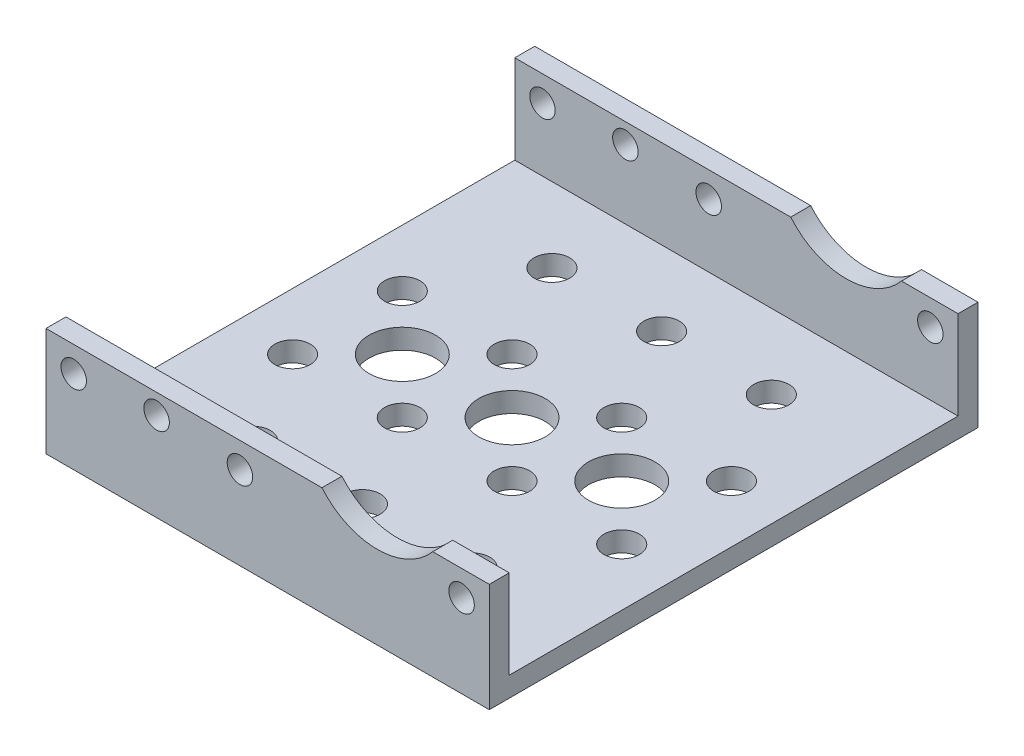
from build123d import *

# Parameters (mm, degrees)
SKETCH_1_W          = 40
SKETCH_1_H          = 40.5
EXTRUDE_1_DEPTH     = 1.8
SKETCH_2_R          = 1.6
SKETCH_2_R_2        = 3
CUT_EXTRUDE_1_DEPTH = 2
SKETCH_3_W          = 40
SKETCH_3_H          = 9.8
EXTRUDE_2_DEPTH     = 1.8
SKETCH_4_R          = 1.15
CUT_EXTRUDE_2_DEPTH = 1.8


with BuildPart() as part:
    # 草图1 → 凸台-拉伸1 (new body)
    with BuildSketch(Plane(origin=(0, 0, 0), x_dir=(1, 0, 0), z_dir=(0, 1, 0))):
        Rectangle(SKETCH_1_W, SKETCH_1_H)
    extrude(amount=EXTRUDE_1_DEPTH)

    # 草图2 → 切除-拉伸1 (cut)
    with BuildSketch(Plane(origin=(0, 1.8, 0), x_dir=(1, 0, 0), z_dir=(0, 1, 0))):
        with Locations(Location((-9.9, 13.5, 0), (0, 0, 270))):
            Circle(SKETCH_2_R)
        with Locations(Location((0, 13.5, 0), (0, 0, 270))):
            Circle(SKETCH_2_R)
        with Locations(Location((9.9, 13.5, 0), (0, 0, 270))):
            Circle(SKETCH_2_R)
        with Locations(Location((0, 0, 0), (0, 0, 270))):
            Circle(SKETCH_2_R_2)
        with Locations(Location((9.9, 0, 0), (0, 0, 270))):
            Circle(SKETCH_2_R_2)
        with Locations(Location((-9.9, 0, 0), (0, 0, 270))):
            Circle(SKETCH_2_R_2)
        with Locations(Location((-9.9, -13.5, 0), (0, 0, 270))):
            Circle(SKETCH_2_R)
        with Locations(Location((0, -13.5, 0), (0, 0, 270))):
            Circle(SKETCH_2_R)
        with Locations(Location((9.9, -13.5, 0), (0, 0, 270))):
            Circle(SKETCH_2_R)
        with Locations(Location((-4.95, 4.949494924, 0), (0, 0, 270))):
            Circle(SKETCH_2_R)
        with Locations(Location((4.95, 4.949494924, 0), (0, 0, 270))):
            Circle(SKETCH_2_R)
        with Locations(Location((14.849494924, 4.95, 0), (0, 0, 270))):
            Circle(SKETCH_2_R)
        with Locations(Location((14.85, -4.949494924, 0), (0, 0, 270))):
            Circle(SKETCH_2_R)
        with Locations(Location((4.950505076, -4.95, 0), (0, 0, 270))):
            Circle(SKETCH_2_R)
        with Locations(Location((-4.950505076, -4.95, 0), (0, 0, 270))):
            Circle(SKETCH_2_R)
        with Locations(Location((-14.85, -4.949494924, 0), (0, 0, 270))):
            Circle(SKETCH_2_R)
        with Locations(Location((-14.849494924, 4.95, 0), (0, 0, 270))):
            Circle(SKETCH_2_R)
    extrude(amount=-CUT_EXTRUDE_1_DEPTH, mode=Mode.SUBTRACT)

    # 草图3 → 凸台-拉伸2 (add)
    with BuildSketch(Plane.XY.offset(20.25)):
        with Locations((0, 4.9)):
            Rectangle(SKETCH_3_W, SKETCH_3_H)
    extrude_2 = extrude(amount=EXTRUDE_2_DEPTH)

    # 草图4 → 切除-拉伸2 (cut)
    with BuildSketch(Plane.XY.offset(22.05)):
        with Locations((-17.5, 7.5)):
            Circle(SKETCH_4_R)
        with Locations((-2.5, 7.5)):
            Circle(SKETCH_4_R)
        with Locations((17.5, 7.5)):
            Circle(SKETCH_4_R)
        with Locations((-10.02, 8)):
            Circle(SKETCH_4_R)
        with BuildLine():
            Line((14.9, 9.8), (4.9, 9.8))
            ThreePointArc((4.9, 9.8), (9.9, 7.48038758), (14.9, 9.8))
        make_face()
    cut_extrude_2 = extrude(amount=-CUT_EXTRUDE_2_DEPTH, mode=Mode.SUBTRACT)

    # 镜向1: 凸台-拉伸2, 切除-拉伸2 across plane
    add(extrude_2.mirror(Plane.XY))
    add(cut_extrude_2.mirror(Plane.XY), mode=Mode.SUBTRACT)


solid = part.part
